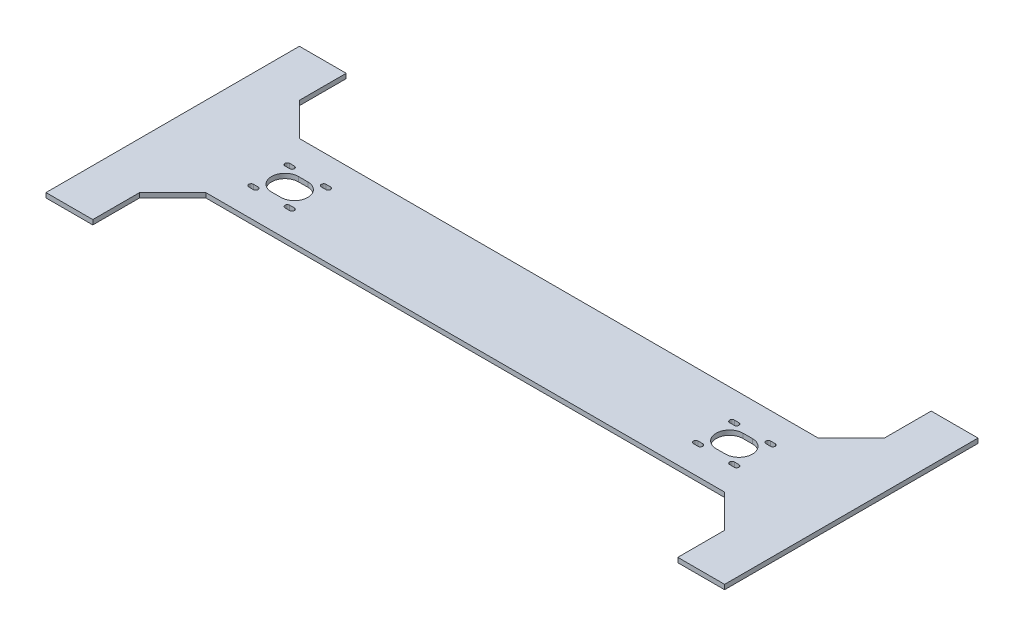
from build123d import *

# Parameters (mm, degrees)
BOSS_EXTRUDE1_DEPTH  = 4
MIRROR6_COPY_1_DEPTH = 4
MIRROR6_COPY_2_DEPTH = 4


with BuildPart() as part:
    # Sketch1 → Boss-Extrude1 (new body)
    with BuildSketch(Plane(origin=(0, 0, 0), x_dir=(1, 0, 0), z_dir=(0, 1, 0))):
        with BuildLine():
            Line((-290, 108.284271247), (-290, 0))
            Line((-290, 0), (-205.5, 0))
            ThreePointArc((-205.5, 0), (-202.131727984, 8.131727984), (-194, 11.5))
            Line((-194, 11.5), (-186, 11.5))
            ThreePointArc((-186, 11.5), (-177.868272016, 8.131727984), (-174.5, 0))
            Line((-174.5, 0), (0, 0))
            Line((0, 0), (0, 40))
            Line((0, 40), (-221.715728753, 40))
            Line((-221.715728753, 40), (-250, 68.284271247))
            Line((-250, 68.284271247), (-250, 108.284271247))
            Line((-250, 108.284271247), (-290, 108.284271247))
        make_face()
        with BuildLine():
            ThreePointArc((-207.499780644, 13.499780644), (-209.499780644, 15.499780644), (-207.499780644, 17.499780644))
            Line((-207.499780644, 17.499780644), (-203.499780644, 17.499780644))
            ThreePointArc((-203.499780644, 17.499780644), (-201.499780644, 15.499780644), (-203.499780644, 13.499780644))
            Line((-203.499780644, 13.499780644), (-207.499780644, 13.499780644))
        make_face(mode=Mode.SUBTRACT)
        with BuildLine():
            Line((-176.500219356, 17.499780644), (-172.500219356, 17.499780644))
            ThreePointArc((-172.500219356, 17.499780644), (-170.500219356, 15.499780644), (-172.500219356, 13.499780644))
            Line((-172.500219356, 13.499780644), (-176.500219356, 13.499780644))
            ThreePointArc((-176.500219356, 13.499780644), (-178.500219356, 15.499780644), (-176.500219356, 17.499780644))
        make_face(mode=Mode.SUBTRACT)
    boss_extrude1 = extrude(amount=BOSS_EXTRUDE1_DEPTH)

    # Mirror1: Boss-Extrude1 across plane
    add(boss_extrude1.mirror(Plane(origin=(0, 4, 0), x_dir=(1, 0, 0), z_dir=(0, 0, -1))))

    # Mirror5: Boss-Extrude1 across plane
    add(boss_extrude1.mirror(Plane(origin=(0, 4, 0), x_dir=(0, 0, 1), z_dir=(1, 0, 0))))

    # Mirror6 copy 1 sketch → Mirror6 copy 1 (add)
    with BuildSketch(Plane(origin=(0, 0, 0), x_dir=(-1, 0, 0), z_dir=(0, 1, 0))):
        with BuildLine():
            Line((-290, 108.284271247), (-290, 0))
            Line((-290, 0), (-205.5, 0))
            ThreePointArc((-205.5, 0), (-202.131727984, 8.131727984), (-194, 11.5))
            Line((-194, 11.5), (-186, 11.5))
            ThreePointArc((-186, 11.5), (-177.868272016, 8.131727984), (-174.5, 0))
            Line((-174.5, 0), (0, 0))
            Line((0, 0), (0, 40))
            Line((0, 40), (-221.715728753, 40))
            Line((-221.715728753, 40), (-250, 68.284271247))
            Line((-250, 68.284271247), (-250, 108.284271247))
            Line((-250, 108.284271247), (-290, 108.284271247))
        make_face()
        with BuildLine():
            ThreePointArc((-207.499780644, 13.499780644), (-209.499780644, 15.499780644), (-207.499780644, 17.499780644))
            Line((-207.499780644, 17.499780644), (-203.499780644, 17.499780644))
            ThreePointArc((-203.499780644, 17.499780644), (-201.499780644, 15.499780644), (-203.499780644, 13.499780644))
            Line((-203.499780644, 13.499780644), (-207.499780644, 13.499780644))
        make_face(mode=Mode.SUBTRACT)
        with BuildLine():
            Line((-176.500219356, 17.499780644), (-172.500219356, 17.499780644))
            ThreePointArc((-172.500219356, 17.499780644), (-170.500219356, 15.499780644), (-172.500219356, 13.499780644))
            Line((-172.500219356, 13.499780644), (-176.500219356, 13.499780644))
            ThreePointArc((-176.500219356, 13.499780644), (-178.500219356, 15.499780644), (-176.500219356, 17.499780644))
        make_face(mode=Mode.SUBTRACT)
    extrude(amount=MIRROR6_COPY_1_DEPTH)

    # Mirror6 copy 2 sketch → Mirror6 copy 2 (add)
    with BuildSketch(Plane(origin=(0, 0, 0), x_dir=(1, 0, 0), z_dir=(0, 1, 0))):
        with BuildLine():
            Line((-290, -108.284271247), (-290, 0))
            Line((-290, 0), (-205.5, 0))
            ThreePointArc((-205.5, 0), (-202.131727984, -8.131727984), (-194, -11.5))
            Line((-194, -11.5), (-186, -11.5))
            ThreePointArc((-186, -11.5), (-177.868272016, -8.131727984), (-174.5, 0))
            Line((-174.5, 0), (0, 0))
            Line((0, 0), (0, -40))
            Line((0, -40), (-221.715728753, -40))
            Line((-221.715728753, -40), (-250, -68.284271247))
            Line((-250, -68.284271247), (-250, -108.284271247))
            Line((-250, -108.284271247), (-290, -108.284271247))
        make_face()
        with BuildLine():
            ThreePointArc((-207.499780644, -13.499780644), (-209.499780644, -15.499780644), (-207.499780644, -17.499780644))
            Line((-207.499780644, -17.499780644), (-203.499780644, -17.499780644))
            ThreePointArc((-203.499780644, -17.499780644), (-201.499780644, -15.499780644), (-203.499780644, -13.499780644))
            Line((-203.499780644, -13.499780644), (-207.499780644, -13.499780644))
        make_face(mode=Mode.SUBTRACT)
        with BuildLine():
            Line((-176.500219356, -17.499780644), (-172.500219356, -17.499780644))
            ThreePointArc((-172.500219356, -17.499780644), (-170.500219356, -15.499780644), (-172.500219356, -13.499780644))
            Line((-172.500219356, -13.499780644), (-176.500219356, -13.499780644))
            ThreePointArc((-176.500219356, -13.499780644), (-178.500219356, -15.499780644), (-176.500219356, -17.499780644))
        make_face(mode=Mode.SUBTRACT)
    extrude(amount=MIRROR6_COPY_2_DEPTH)


solid = part.part
